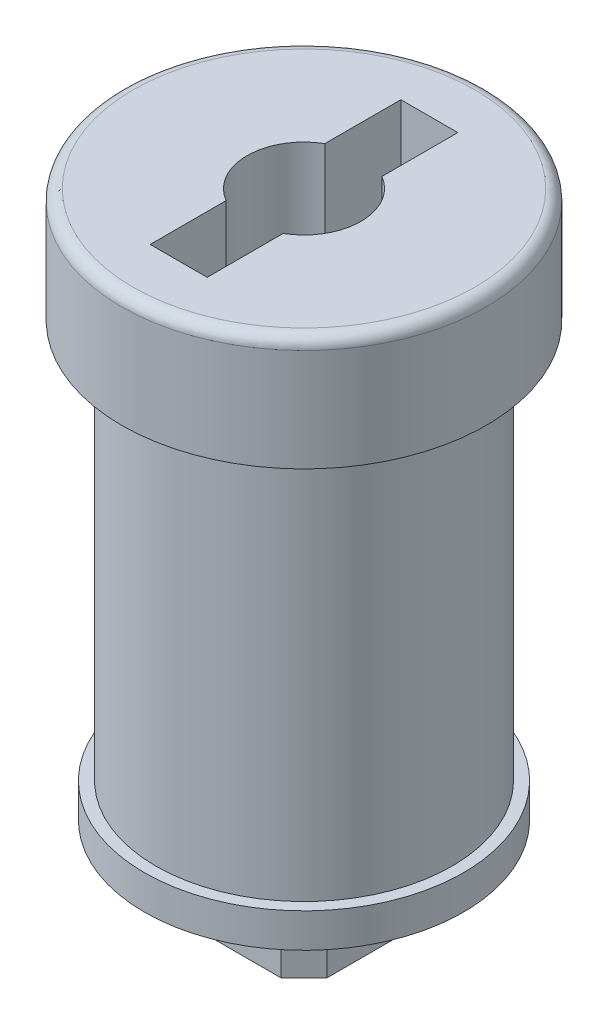
from build123d import *

# Parameters (mm, degrees)
SKETCH2_W             = 2.5
SKETCH2_H             = 11
CUT_EXTRUDE1_DEPTH    = 10
SKETCH3_R             = 2.5
CUT_EXTRUDE2_DEPTH    = 10
FILLET1_R             = 0.5
SKETCH4_W             = 8
SKETCH4_H             = 8
BOSS_EXTRUDE1_DEPTH   = 2.5
CHAMFER1_SIZE         = 1
M5_TAPPED_HOLE1_D     = 4.2
M5_TAPPED_HOLE1_DEPTH = 8
M5_TAPPED_HOLE1_TIP   = 1.2618073


with BuildPart() as part:
    # Sketch1 → Revolve1 (revolve)
    with BuildSketch(Plane.XY, mode=Mode.PRIVATE) as revolve1_sk:
        Polygon((0, 0), (7, 0), (7, 1.5), (6.5, 1.5), (6.5, 19), (8, 19), (8, 24), (0, 24), align=None)
    revolve(revolve1_sk.sketch.rotate(Axis((0, 24, 0), (0, -1, 0)), 90), axis=Axis((0, 24, 0), (0, -1, 0)))

    # Sketch2 → Cut-Extrude1 (cut)
    with BuildSketch(Plane(origin=(0, 24, 0), x_dir=(1, 0, 0), z_dir=(0, 1, 0))):
        Rectangle(SKETCH2_W, SKETCH2_H)
    extrude(amount=-CUT_EXTRUDE1_DEPTH, mode=Mode.SUBTRACT)

    # Sketch3 → Cut-Extrude2 (cut)
    with BuildSketch(Plane(origin=(0, 24, 0), x_dir=(1, 0, 0), z_dir=(0, 1, 0))):
        Circle(SKETCH3_R)
    extrude(amount=-CUT_EXTRUDE2_DEPTH, mode=Mode.SUBTRACT)

    # Fillet1
    fillet1_edges = [part.edges().sort_by_distance(p)[0] for p in [
        (0, 24, -8),
    ]]
    fillet(fillet1_edges, radius=FILLET1_R)

    # Sketch4 → Boss-Extrude1 (add)
    with BuildSketch(Plane.XZ):
        Rectangle(SKETCH4_W, SKETCH4_H)
    extrude(amount=BOSS_EXTRUDE1_DEPTH)

    # Chamfer1
    chamfer1_edges = [part.edges().sort_by_distance(p)[0] for p in [
        (4, -1.25, -4),
        (4, -1.25, 4),
        (-4, -1.25, 4),
        (-4, -1.25, -4),
    ]]
    chamfer(chamfer1_edges, length=CHAMFER1_SIZE)

    # M5 Tapped Hole1
    with Locations(Plane(origin=(0, -2.5, 0), x_dir=(-1, 0, 0), z_dir=(0, -1, 0))):
        with Locations((0, 0)):
            Hole(M5_TAPPED_HOLE1_D / 2, depth=M5_TAPPED_HOLE1_DEPTH)
            with Locations((0, 0, -(M5_TAPPED_HOLE1_DEPTH + M5_TAPPED_HOLE1_TIP / 2))):  # 118° drill point
                Cone(0, M5_TAPPED_HOLE1_D / 2, M5_TAPPED_HOLE1_TIP, mode=Mode.SUBTRACT)


solid = part.part
